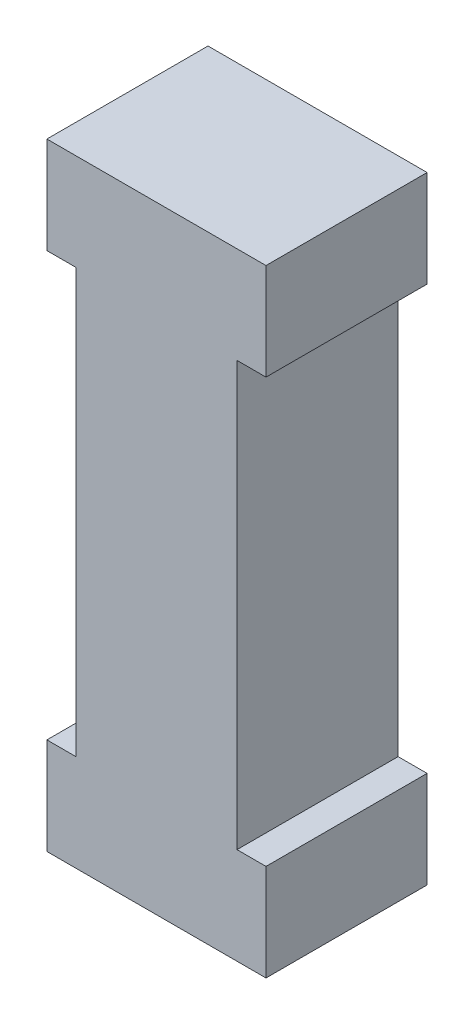
from build123d import *

# Parameters (mm, degrees)
BOSS_EXTRUDE1_DEPTH = 5


with BuildPart() as part:
    # Sketch1 → Boss-Extrude1 (new body)
    with BuildSketch(Plane.XY):
        Polygon((0, 0), (0, 13.15), (0.9, 13.15), (0.9, 16.15), (-5.9, 16.15), (-5.9, 13.15), (-5, 13.15), (-5, 0), (-5.9, 0), (-5.9, -3), (0.9, -3), (0.9, 0), align=None)
    extrude(amount=BOSS_EXTRUDE1_DEPTH)


solid = part.part
